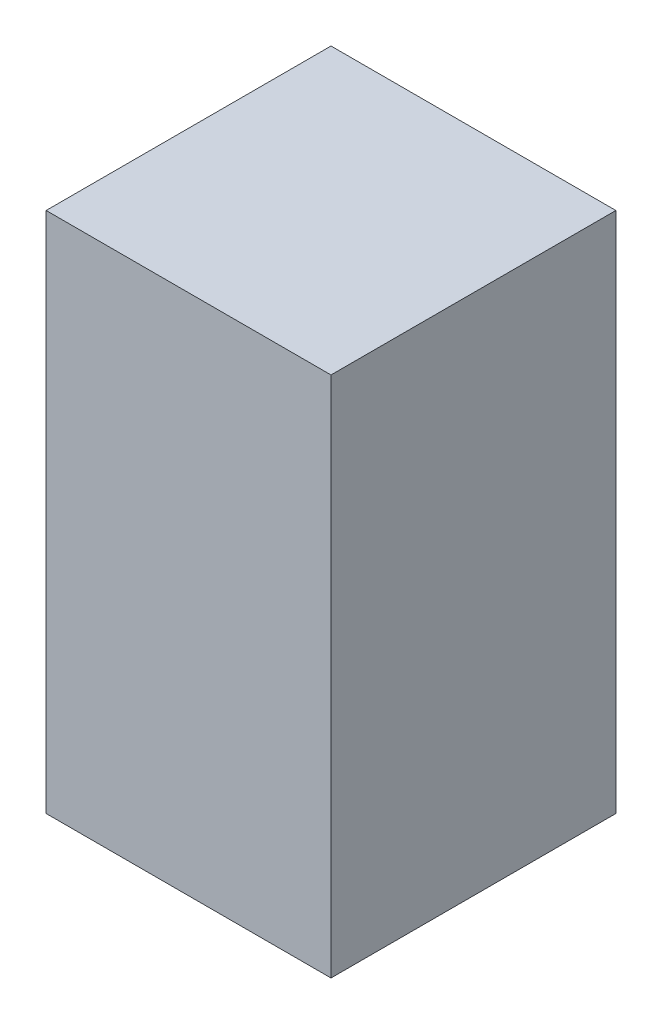
from build123d import *

# Parameters (mm, degrees)
SKETCH1_W           = 60
SKETCH1_H           = 60
BOSS_EXTRUDE1_DEPTH = 110


with BuildPart() as part:
    # Sketch1 → Boss-Extrude1 (new body)
    with BuildSketch(Plane(origin=(0, 0, 0), x_dir=(1, 0, 0), z_dir=(0, 1, 0))):
        Rectangle(SKETCH1_W, SKETCH1_H)
    extrude(amount=BOSS_EXTRUDE1_DEPTH)


solid = part.part
